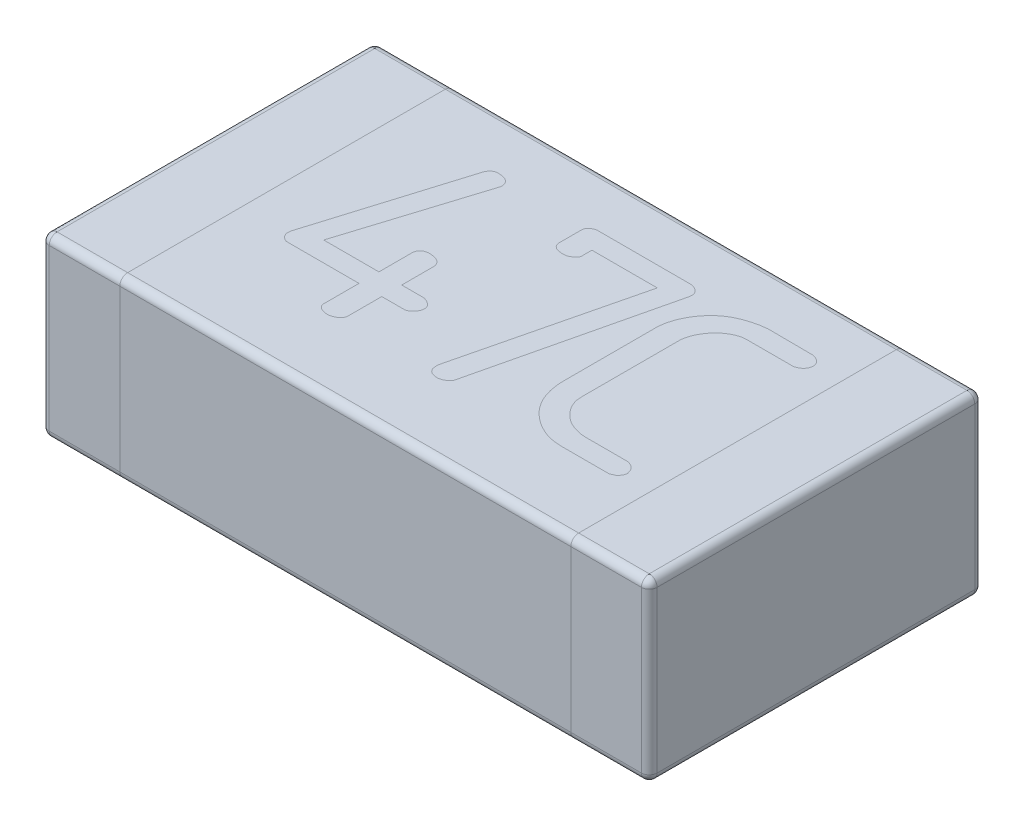
from build123d import *

# Parameters (mm, degrees)
BOSS_EXTRUDE1_DEPTH = 0.225
FILLET2_R           = 0.02


with BuildPart() as part:
    # Sketch1 → Boss-Extrude1 (new, symmetric)
    with BuildSketch(Plane(origin=(0, 0, 0), x_dir=(1, 0, 0), z_dir=(0, 1, 0))):
        with BuildLine():
            Line((-0.755, -0.425), (0.755, -0.425))
            ThreePointArc((0.755, -0.425), (0.769142136, -0.419142136), (0.775, -0.405))
            Line((0.775, -0.405), (0.775, 0.405))
            ThreePointArc((0.775, 0.405), (0.769142136, 0.419142136), (0.755, 0.425))
            Line((0.755, 0.425), (-0.755, 0.425))
            ThreePointArc((-0.755, 0.425), (-0.769142136, 0.419142136), (-0.775, 0.405))
            Line((-0.775, 0.405), (-0.775, -0.405))
            ThreePointArc((-0.775, -0.405), (-0.769142136, -0.419142136), (-0.755, -0.425))
        make_face()
    extrude(amount=BOSS_EXTRUDE1_DEPTH, both=True)

    # Fillet2
    fillet2_edges = [part.edges().sort_by_distance(p)[0] for p in [
        (0.769142136, 0.225, 0.419142136),
        (0, -0.225, 0.425),
        (0, -0.225, 0.425),
        (-0.769142136, -0.225, 0.419142136),
        (0, -0.225, 0.425),
        (0, -0.225, -0.425),
        (0, -0.225, -0.425),
        (0.775, 0.225, 0),
        (0.769142136, 0.225, -0.419142136),
        (0, 0.225, -0.425),
        (-0.769142136, 0.225, -0.419142136),
        (-0.775, 0.225, 0),
        (-0.769142136, 0.225, 0.419142136),
        (0, 0.225, 0.425),
        (-0.775, -0.225, 0),
        (0, 0.225, 0.425),
        (0, 0.225, -0.425),
        (-0.769142136, -0.225, -0.419142136),
        (0, -0.225, -0.425),
        (0, 0.225, -0.425),
        (0, 0.225, 0.425),
        (0.769142136, -0.225, -0.419142136),
        (0.775, -0.225, 0),
        (0.769142136, -0.225, 0.419142136),
    ]]
    fillet(fillet2_edges, radius=FILLET2_R)


solid = part.part
